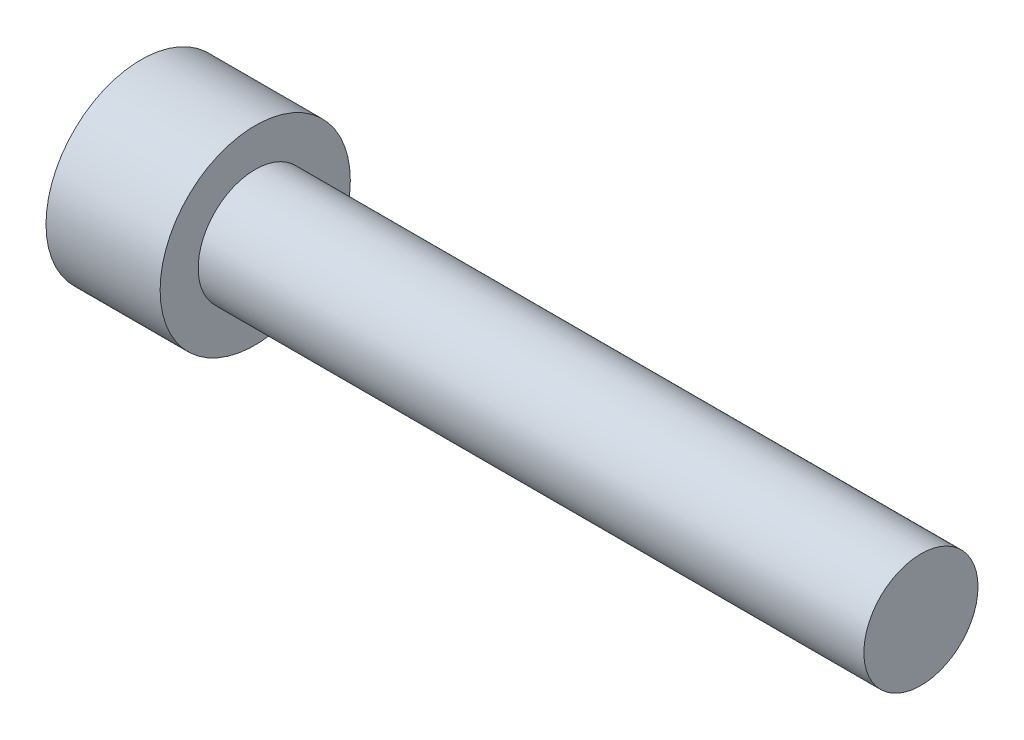
from build123d import *

# Parameters (mm, degrees)
SKETCH_1_R          = 5
EXTRUDE_1_DEPTH     = 6
CUT_EXTRUDE_1_DEPTH = 3
SKETCH_3_R          = 3
EXTRUDE_2_DEPTH     = 35


with BuildPart() as part:
    # 草图1 → 凸台-拉伸1 (new body)
    with BuildSketch(Plane(origin=(0, 0, 0), x_dir=(0, 0, -1), z_dir=(1, 0, 0))):
        Circle(SKETCH_1_R)
    extrude(amount=EXTRUDE_1_DEPTH)

    # 草图2 → 切除-拉伸1 (cut)
    with BuildSketch(Plane.ZY):
        Polygon((-2.165063509, 1.25), (0, 2.5), (2.165063509, 1.25), (2.165063509, -1.25), (0, -2.5), (-2.165063509, -1.25), align=None)
    extrude(amount=-CUT_EXTRUDE_1_DEPTH, mode=Mode.SUBTRACT)

    # 草图3 → 凸台-拉伸2 (add)
    with BuildSketch(Plane(origin=(6, 0, 0), x_dir=(0, 0, -1), z_dir=(1, 0, 0))):
        Circle(SKETCH_3_R)
    extrude(amount=EXTRUDE_2_DEPTH)


solid = part.part
